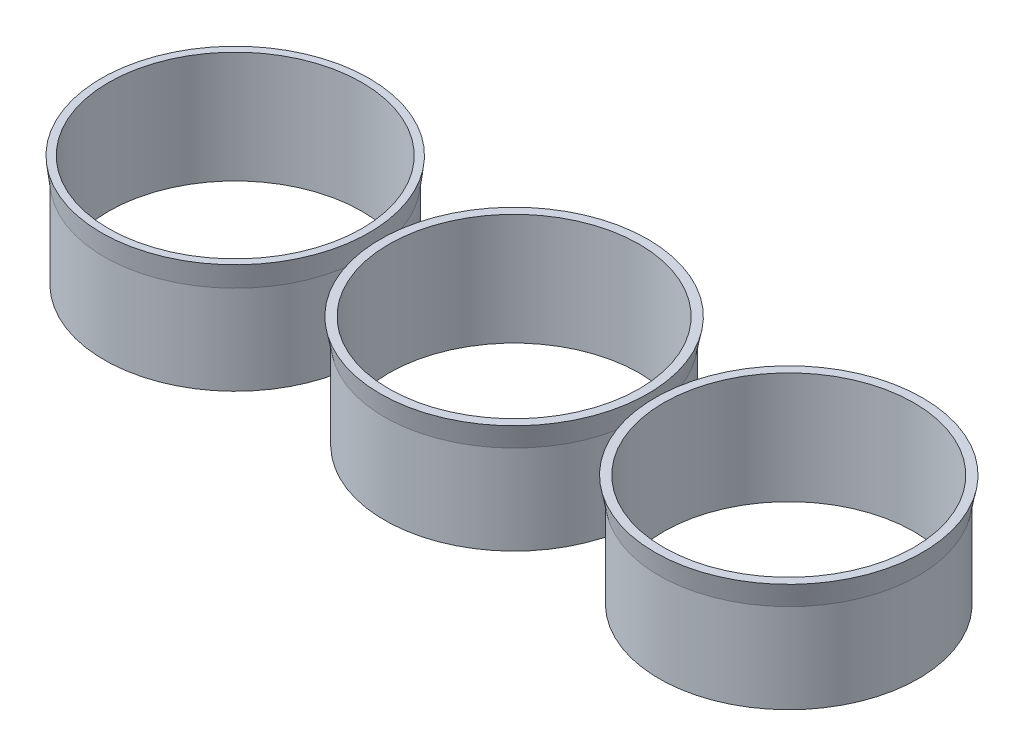
from build123d import *


with BuildPart() as part:
    # Sketch2 → Revolve1 (revolve)
    with BuildSketch(Plane.XY, mode=Mode.PRIVATE) as revolve1_sk:
        Polygon((22.7, 0), (22.7, 20), (24, 20), (23.5, 16), (23.5, 0), align=None)
    revolve(revolve1_sk.sketch.rotate(Axis((0, 0, 0), (0, 1, 0)), 90), axis=Axis((0, 0, 0), (0, 1, 0)))


with BuildPart() as body_2:
    # Sketch3 → Revolve2 (revolve)
    with BuildSketch(Plane.XY, mode=Mode.PRIVATE) as revolve2_sk:
        Polygon((73.25, 0), (73.25, 16), (74, 20), (72.45, 20), (72.45, 0), align=None)
    revolve(revolve2_sk.sketch.rotate(Axis((50, 0, 0), (0, 1, 0)), 90), axis=Axis((50, 0, 0), (0, 1, 0)))


with BuildPart() as body_3:
    # Sketch4 → Revolve3 (revolve)
    with BuildSketch(Plane.XY, mode=Mode.PRIVATE) as revolve3_sk:
        Polygon((122.5, 0), (122.5, 16), (123.25, 20), (121.7, 20), (121.7, 0), align=None)
    revolve(revolve3_sk.sketch.rotate(Axis((99.25, 0, 0), (0, 1, 0)), 90), axis=Axis((99.25, 0, 0), (0, 1, 0)))


solid = Compound([part.part, body_2.part, body_3.part])
